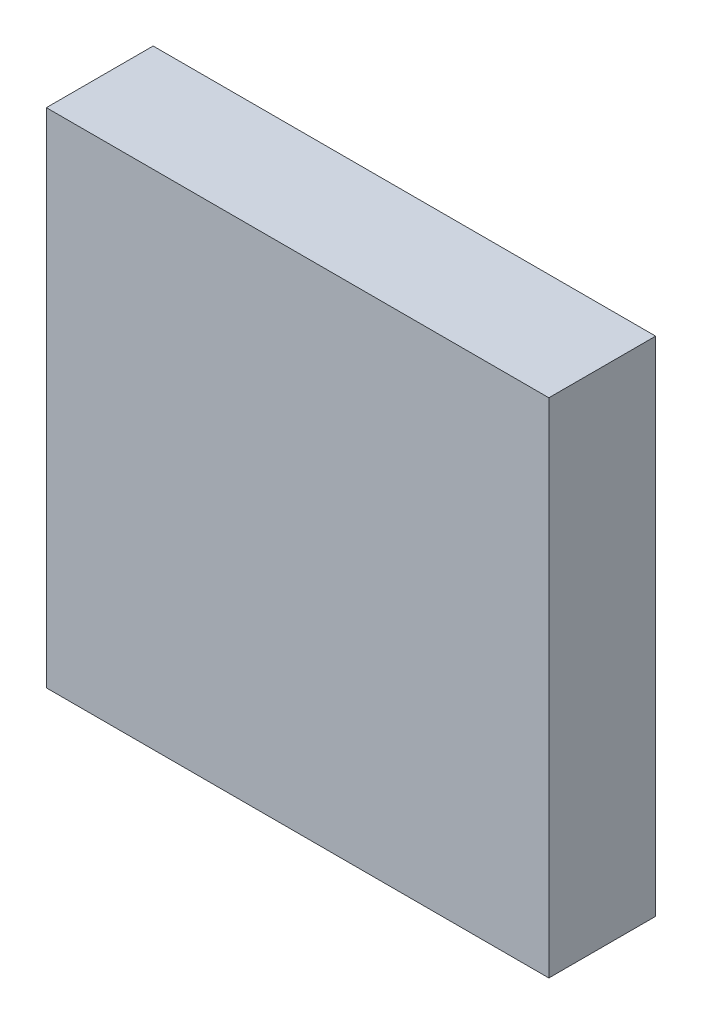
from build123d import *

# Parameters (mm, degrees)
COMPONENT_OUTLINE_DEPTH = 1.7


with BuildPart() as part:
    # 草图1 → Component_Outline (new body)
    with BuildSketch(Plane.XY):
        Polygon((-4, 4), (4, 4), (4, -4), (-4, -4), (-4, 3.2), align=None)
    extrude(amount=COMPONENT_OUTLINE_DEPTH)


solid = part.part
